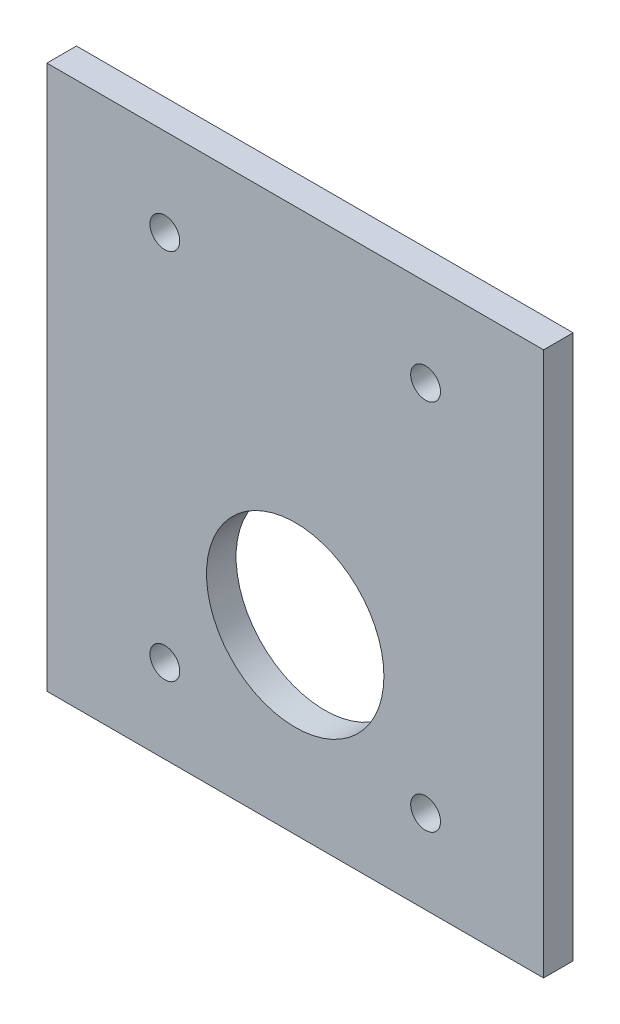
from build123d import *

# Parameters (mm, degrees)
SKETCH1_W           = 53.34
SKETCH1_H           = 58.42
SKETCH1_R           = 9.525
SKETCH1_R_2         = 1.6
BOSS_EXTRUDE1_DEPTH = 3.175


with BuildPart() as part:
    # Sketch1 → Boss-Extrude1 (new body)
    with BuildSketch(Plane.XY):
        with Locations((0, 9.71)):
            Rectangle(SKETCH1_W, SKETCH1_H)
        Circle(SKETCH1_R, mode=Mode.SUBTRACT)
        with Locations((-14, 29.5)):
            Circle(SKETCH1_R_2, mode=Mode.SUBTRACT)
        with Locations((14, 29.5)):
            Circle(SKETCH1_R_2, mode=Mode.SUBTRACT)
        with Locations((14, -10.5)):
            Circle(SKETCH1_R_2, mode=Mode.SUBTRACT)
        with Locations((-14, -10.5)):
            Circle(SKETCH1_R_2, mode=Mode.SUBTRACT)
    extrude(amount=BOSS_EXTRUDE1_DEPTH)


solid = part.part
